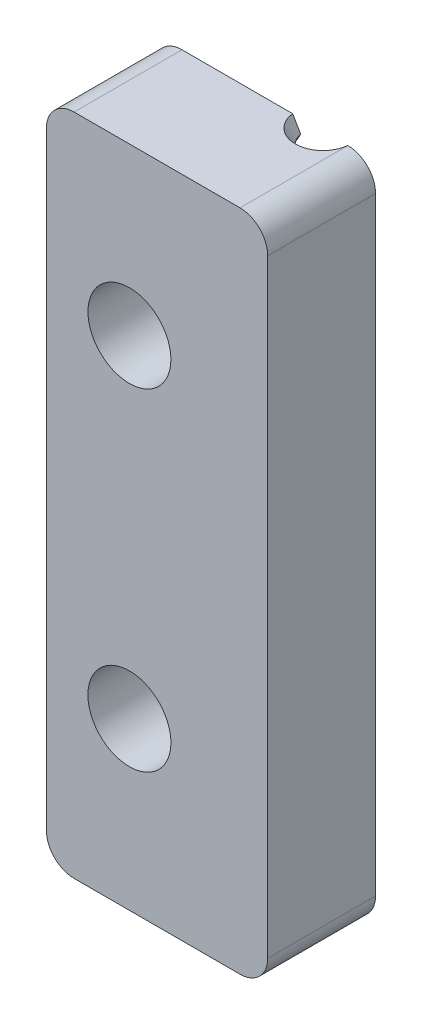
from build123d import *

# Parameters (mm, degrees)
ESQUISSE1_W                           = 8
ESQUISSE1_H                           = 3.9
BOSS_EXTRU_1_DEPTH                    = 12
ESQUISSE2_R                           = 1.5
ENL_V_MAT_EXTRU_1_DEPTH               = 14.23669143
ESQUISSE3_R                           = 1
ENL_V_MAT_EXTRU_2_DEPTH               = 0.5
ENL_V_MAT_EXTRU_2_DRAFT               = -30
ESQUISSE4_R                           = 0.711324865
ENL_V_MAT_EXTRU_3_DEPTH               = 0.5
ENL_V_MAT_EXTRU_3_DRAFT               = 30
R_P_TITION_LIN_AIRE1_COPY_1_SKETCH_R  = 1
R_P_TITION_LIN_AIRE1_COPY_1_DEPTH     = 0.5
R_P_TITION_LIN_AIRE1_COPY_1_DRAFT     = -30
R_P_TITION_LIN_AIRE1_COPY_2_SKETCH_R  = 1
R_P_TITION_LIN_AIRE1_COPY_2_DEPTH     = 0.5
R_P_TITION_LIN_AIRE1_COPY_2_DRAFT     = -30
R_P_TITION_LIN_AIRE1_COPY_3_SKETCH_R  = 1
R_P_TITION_LIN_AIRE1_COPY_3_DEPTH     = 0.5
R_P_TITION_LIN_AIRE1_COPY_3_DRAFT     = -30
R_P_TITION_LIN_AIRE1_COPY_4_SKETCH_R  = 1
R_P_TITION_LIN_AIRE1_COPY_4_DEPTH     = 0.5
R_P_TITION_LIN_AIRE1_COPY_4_DRAFT     = -30
R_P_TITION_LIN_AIRE1_COPY_5_SKETCH_R  = 1
R_P_TITION_LIN_AIRE1_COPY_5_DEPTH     = 0.5
R_P_TITION_LIN_AIRE1_COPY_5_DRAFT     = -30
R_P_TITION_LIN_AIRE1_COPY_6_SKETCH_R  = 1
R_P_TITION_LIN_AIRE1_COPY_6_DEPTH     = 0.5
R_P_TITION_LIN_AIRE1_COPY_6_DRAFT     = -30
R_P_TITION_LIN_AIRE1_COPY_7_SKETCH_R  = 1
R_P_TITION_LIN_AIRE1_COPY_7_DEPTH     = 0.5
R_P_TITION_LIN_AIRE1_COPY_7_DRAFT     = -30
R_P_TITION_LIN_AIRE1_COPY_8_SKETCH_R  = 1
R_P_TITION_LIN_AIRE1_COPY_8_DEPTH     = 0.5
R_P_TITION_LIN_AIRE1_COPY_8_DRAFT     = -30
R_P_TITION_LIN_AIRE1_COPY_9_SKETCH_R  = 1
R_P_TITION_LIN_AIRE1_COPY_9_DEPTH     = 0.5
R_P_TITION_LIN_AIRE1_COPY_9_DRAFT     = -30
R_P_TITION_LIN_AIRE1_COPY_10_SKETCH_R = 1
R_P_TITION_LIN_AIRE1_COPY_10_DEPTH    = 0.5
R_P_TITION_LIN_AIRE1_COPY_10_DRAFT    = -30
R_P_TITION_LIN_AIRE1_COPY_11_SKETCH_R = 1
R_P_TITION_LIN_AIRE1_COPY_11_DEPTH    = 0.5
R_P_TITION_LIN_AIRE1_COPY_11_DRAFT    = -30
R_P_TITION_LIN_AIRE1_COPY_12_SKETCH_R = 1
R_P_TITION_LIN_AIRE1_COPY_12_DEPTH    = 0.5
R_P_TITION_LIN_AIRE1_COPY_12_DRAFT    = -30
R_P_TITION_LIN_AIRE1_COPY_13_SKETCH_R = 1
R_P_TITION_LIN_AIRE1_COPY_13_DEPTH    = 0.5
R_P_TITION_LIN_AIRE1_COPY_13_DRAFT    = -30
R_P_TITION_LIN_AIRE1_COPY_14_SKETCH_R = 1
R_P_TITION_LIN_AIRE1_COPY_14_DEPTH    = 0.5
R_P_TITION_LIN_AIRE1_COPY_14_DRAFT    = -30
R_P_TITION_LIN_AIRE1_COPY_15_SKETCH_R = 1
R_P_TITION_LIN_AIRE1_COPY_15_DEPTH    = 0.5
R_P_TITION_LIN_AIRE1_COPY_15_DRAFT    = -30
R_P_TITION_LIN_AIRE1_COPY_16_SKETCH_R = 1
R_P_TITION_LIN_AIRE1_COPY_16_DEPTH    = 0.5
R_P_TITION_LIN_AIRE1_COPY_16_DRAFT    = -30
R_P_TITION_LIN_AIRE1_COPY_17_SKETCH_R = 1
R_P_TITION_LIN_AIRE1_COPY_17_DEPTH    = 0.5
R_P_TITION_LIN_AIRE1_COPY_17_DRAFT    = -30
R_P_TITION_LIN_AIRE1_COPY_18_SKETCH_R = 1
R_P_TITION_LIN_AIRE1_COPY_18_DEPTH    = 0.5
R_P_TITION_LIN_AIRE1_COPY_18_DRAFT    = -30
R_P_TITION_LIN_AIRE1_COPY_19_SKETCH_R = 1
R_P_TITION_LIN_AIRE1_COPY_19_DEPTH    = 0.5
R_P_TITION_LIN_AIRE1_COPY_19_DRAFT    = -30
R_P_TITION_LIN_AIRE1_COPY_20_SKETCH_R = 1
R_P_TITION_LIN_AIRE1_COPY_20_DEPTH    = 0.5
R_P_TITION_LIN_AIRE1_COPY_20_DRAFT    = -30
R_P_TITION_LIN_AIRE1_COPY_21_SKETCH_R = 1
R_P_TITION_LIN_AIRE1_COPY_21_DEPTH    = 0.5
R_P_TITION_LIN_AIRE1_COPY_21_DRAFT    = -30
R_P_TITION_LIN_AIRE1_COPY_22_SKETCH_R = 1
R_P_TITION_LIN_AIRE1_COPY_22_DEPTH    = 0.5
R_P_TITION_LIN_AIRE1_COPY_22_DRAFT    = -30
R_P_TITION_LIN_AIRE1_COPY_23_SKETCH_R = 1
R_P_TITION_LIN_AIRE1_COPY_23_DEPTH    = 0.5
R_P_TITION_LIN_AIRE1_COPY_23_DRAFT    = -30
R_P_TITION_LIN_AIRE1_COPY_24_SKETCH_R = 0.711324865
R_P_TITION_LIN_AIRE1_COPY_24_DEPTH    = 0.5
R_P_TITION_LIN_AIRE1_COPY_24_DRAFT    = 30
R_P_TITION_LIN_AIRE1_COPY_25_SKETCH_R = 0.711324865
R_P_TITION_LIN_AIRE1_COPY_25_DEPTH    = 0.5
R_P_TITION_LIN_AIRE1_COPY_25_DRAFT    = 30
R_P_TITION_LIN_AIRE1_COPY_26_SKETCH_R = 0.711324865
R_P_TITION_LIN_AIRE1_COPY_26_DEPTH    = 0.5
R_P_TITION_LIN_AIRE1_COPY_26_DRAFT    = 30
R_P_TITION_LIN_AIRE1_COPY_27_SKETCH_R = 0.711324865
R_P_TITION_LIN_AIRE1_COPY_27_DEPTH    = 0.5
R_P_TITION_LIN_AIRE1_COPY_27_DRAFT    = 30
R_P_TITION_LIN_AIRE1_COPY_28_SKETCH_R = 0.711324865
R_P_TITION_LIN_AIRE1_COPY_28_DEPTH    = 0.5
R_P_TITION_LIN_AIRE1_COPY_28_DRAFT    = 30
R_P_TITION_LIN_AIRE1_COPY_29_SKETCH_R = 0.711324865
R_P_TITION_LIN_AIRE1_COPY_29_DEPTH    = 0.5
R_P_TITION_LIN_AIRE1_COPY_29_DRAFT    = 30
R_P_TITION_LIN_AIRE1_COPY_30_SKETCH_R = 0.711324865
R_P_TITION_LIN_AIRE1_COPY_30_DEPTH    = 0.5
R_P_TITION_LIN_AIRE1_COPY_30_DRAFT    = 30
R_P_TITION_LIN_AIRE1_COPY_31_SKETCH_R = 0.711324865
R_P_TITION_LIN_AIRE1_COPY_31_DEPTH    = 0.5
R_P_TITION_LIN_AIRE1_COPY_31_DRAFT    = 30
R_P_TITION_LIN_AIRE1_COPY_32_SKETCH_R = 0.711324865
R_P_TITION_LIN_AIRE1_COPY_32_DEPTH    = 0.5
R_P_TITION_LIN_AIRE1_COPY_32_DRAFT    = 30
R_P_TITION_LIN_AIRE1_COPY_33_SKETCH_R = 0.711324865
R_P_TITION_LIN_AIRE1_COPY_33_DEPTH    = 0.5
R_P_TITION_LIN_AIRE1_COPY_33_DRAFT    = 30
R_P_TITION_LIN_AIRE1_COPY_34_SKETCH_R = 0.711324865
R_P_TITION_LIN_AIRE1_COPY_34_DEPTH    = 0.5
R_P_TITION_LIN_AIRE1_COPY_34_DRAFT    = 30
R_P_TITION_LIN_AIRE1_COPY_35_SKETCH_R = 0.711324865
R_P_TITION_LIN_AIRE1_COPY_35_DEPTH    = 0.5
R_P_TITION_LIN_AIRE1_COPY_35_DRAFT    = 30
R_P_TITION_LIN_AIRE1_COPY_36_SKETCH_R = 0.711324865
R_P_TITION_LIN_AIRE1_COPY_36_DEPTH    = 0.5
R_P_TITION_LIN_AIRE1_COPY_36_DRAFT    = 30
R_P_TITION_LIN_AIRE1_COPY_37_SKETCH_R = 0.711324865
R_P_TITION_LIN_AIRE1_COPY_37_DEPTH    = 0.5
R_P_TITION_LIN_AIRE1_COPY_37_DRAFT    = 30
R_P_TITION_LIN_AIRE1_COPY_38_SKETCH_R = 0.711324865
R_P_TITION_LIN_AIRE1_COPY_38_DEPTH    = 0.5
R_P_TITION_LIN_AIRE1_COPY_38_DRAFT    = 30
R_P_TITION_LIN_AIRE1_COPY_39_SKETCH_R = 0.711324865
R_P_TITION_LIN_AIRE1_COPY_39_DEPTH    = 0.5
R_P_TITION_LIN_AIRE1_COPY_39_DRAFT    = 30
R_P_TITION_LIN_AIRE1_COPY_40_SKETCH_R = 0.711324865
R_P_TITION_LIN_AIRE1_COPY_40_DEPTH    = 0.5
R_P_TITION_LIN_AIRE1_COPY_40_DRAFT    = 30
R_P_TITION_LIN_AIRE1_COPY_41_SKETCH_R = 0.711324865
R_P_TITION_LIN_AIRE1_COPY_41_DEPTH    = 0.5
R_P_TITION_LIN_AIRE1_COPY_41_DRAFT    = 30
R_P_TITION_LIN_AIRE1_COPY_42_SKETCH_R = 0.711324865
R_P_TITION_LIN_AIRE1_COPY_42_DEPTH    = 0.5
R_P_TITION_LIN_AIRE1_COPY_42_DRAFT    = 30
R_P_TITION_LIN_AIRE1_COPY_43_SKETCH_R = 0.711324865
R_P_TITION_LIN_AIRE1_COPY_43_DEPTH    = 0.5
R_P_TITION_LIN_AIRE1_COPY_43_DRAFT    = 30
R_P_TITION_LIN_AIRE1_COPY_44_SKETCH_R = 0.711324865
R_P_TITION_LIN_AIRE1_COPY_44_DEPTH    = 0.5
R_P_TITION_LIN_AIRE1_COPY_44_DRAFT    = 30
R_P_TITION_LIN_AIRE1_COPY_45_SKETCH_R = 0.711324865
R_P_TITION_LIN_AIRE1_COPY_45_DEPTH    = 0.5
R_P_TITION_LIN_AIRE1_COPY_45_DRAFT    = 30
R_P_TITION_LIN_AIRE1_COPY_46_SKETCH_R = 0.711324865
R_P_TITION_LIN_AIRE1_COPY_46_DEPTH    = 0.5
R_P_TITION_LIN_AIRE1_COPY_46_DRAFT    = 30
CONG_1_R                              = 1


with BuildPart() as part:
    # Esquisse1 → Boss.-Extru.1 (new, symmetric)
    with BuildSketch(Plane(origin=(0, 0, 0), x_dir=(1, 0, 0), z_dir=(0, 1, 0))):
        with Locations((0, 1.95)):
            Rectangle(ESQUISSE1_W, ESQUISSE1_H)
    extrude(amount=BOSS_EXTRU_1_DEPTH, both=True)

    # Esquisse2 → Enlèv. mat.-Extru.1 (cut, through all)
    with BuildSketch(Plane.XY):
        with Locations((-1, 6)):
            Circle(ESQUISSE2_R)
        with Locations(Location((-1, -6, 0), (0, 0, 180))):
            Circle(ESQUISSE2_R)
    extrude(amount=-ENL_V_MAT_EXTRU_1_DEPTH, mode=Mode.SUBTRACT)


with BuildPart() as enl_v_mat_extru_2_tool:
    # Esquisse3 → Enlèv. mat.-Extru.2 (with draft: the straight prism first)
    with BuildSketch(Plane(origin=(0, 12, 0), x_dir=(1, 0, 0), z_dir=(0, 1, 0))):
        with Locations((2, 4)):
            Circle(ESQUISSE3_R)
    extrude(amount=-ENL_V_MAT_EXTRU_2_DEPTH)
    # Enlèv. mat.-Extru.2: the draft: its side faces are tilted about the plane it starts from
    enl_v_mat_extru_2_sides = [enl_v_mat_extru_2_tool.faces().sort_by_distance(p)[0] for p in [
        (1, 11.75, -4),
    ]]
    draft(enl_v_mat_extru_2_sides, Plane(origin=(0, 12, 0), x_dir=(1, 0, 0), z_dir=(0, 1, 0)), ENL_V_MAT_EXTRU_2_DRAFT)


with BuildPart() as part_1:
    add(part.part)

    # Enlèv. mat.-Extru.2: cut by enl_v_mat_extru_2_tool
    add(enl_v_mat_extru_2_tool.part, mode=Mode.SUBTRACT)


with BuildPart() as enl_v_mat_extru_3_tool:
    # Esquisse4 → Enlèv. mat.-Extru.3 (with draft: the straight prism first)
    with BuildSketch(Plane(origin=(0, 11.5, 0), x_dir=(1, 0, 0), z_dir=(0, 1, 0))):
        with Locations((2, 4)):
            Circle(ESQUISSE4_R)
    extrude(amount=-ENL_V_MAT_EXTRU_3_DEPTH)
    # Enlèv. mat.-Extru.3: the draft: its side faces are tilted about the plane it starts from
    enl_v_mat_extru_3_sides = [enl_v_mat_extru_3_tool.faces().sort_by_distance(p)[0] for p in [
        (1.288675135, 11.25, -4),
    ]]
    draft(enl_v_mat_extru_3_sides, Plane(origin=(0, 11.5, 0), x_dir=(1, 0, 0), z_dir=(0, 1, 0)), ENL_V_MAT_EXTRU_3_DRAFT)


with BuildPart() as part_2:
    add(part_1.part)

    # Enlèv. mat.-Extru.3: cut by enl_v_mat_extru_3_tool
    add(enl_v_mat_extru_3_tool.part, mode=Mode.SUBTRACT)


with BuildPart() as r_p_tition_lin_aire1_copy_1_tool:
    # Répétition linéaire1 copy 1 sketch → Répétition linéaire1 copy 1 (with draft: the straight prism first)
    with BuildSketch(Plane(origin=(0, 11, 0), x_dir=(1, 0, 0), z_dir=(0, 1, 0))):
        with Locations((2, 4)):
            Circle(R_P_TITION_LIN_AIRE1_COPY_1_SKETCH_R)
    extrude(amount=-R_P_TITION_LIN_AIRE1_COPY_1_DEPTH)
    # Répétition linéaire1 copy 1: the draft: its side faces are tilted about the plane it starts from
    r_p_tition_lin_aire1_copy_1_sides = [r_p_tition_lin_aire1_copy_1_tool.faces().sort_by_distance(p)[0] for p in [
        (1, 10.75, -4),
    ]]
    draft(r_p_tition_lin_aire1_copy_1_sides, Plane(origin=(0, 11, 0), x_dir=(1, 0, 0), z_dir=(0, 1, 0)), R_P_TITION_LIN_AIRE1_COPY_1_DRAFT)


with BuildPart() as part_3:
    add(part_2.part)

    # Répétition linéaire1 copy 1: cut by r_p_tition_lin_aire1_copy_1_tool
    add(r_p_tition_lin_aire1_copy_1_tool.part, mode=Mode.SUBTRACT)


with BuildPart() as r_p_tition_lin_aire1_copy_2_tool:
    # Répétition linéaire1 copy 2 sketch → Répétition linéaire1 copy 2 (with draft: the straight prism first)
    with BuildSketch(Plane(origin=(0, 10, 0), x_dir=(1, 0, 0), z_dir=(0, 1, 0))):
        with Locations((2, 4)):
            Circle(R_P_TITION_LIN_AIRE1_COPY_2_SKETCH_R)
    extrude(amount=-R_P_TITION_LIN_AIRE1_COPY_2_DEPTH)
    # Répétition linéaire1 copy 2: the draft: its side faces are tilted about the plane it starts from
    r_p_tition_lin_aire1_copy_2_sides = [r_p_tition_lin_aire1_copy_2_tool.faces().sort_by_distance(p)[0] for p in [
        (1, 9.75, -4),
    ]]
    draft(r_p_tition_lin_aire1_copy_2_sides, Plane(origin=(0, 10, 0), x_dir=(1, 0, 0), z_dir=(0, 1, 0)), R_P_TITION_LIN_AIRE1_COPY_2_DRAFT)


with BuildPart() as part_4:
    add(part_3.part)

    # Répétition linéaire1 copy 2: cut by r_p_tition_lin_aire1_copy_2_tool
    add(r_p_tition_lin_aire1_copy_2_tool.part, mode=Mode.SUBTRACT)


with BuildPart() as r_p_tition_lin_aire1_copy_3_tool:
    # Répétition linéaire1 copy 3 sketch → Répétition linéaire1 copy 3 (with draft: the straight prism first)
    with BuildSketch(Plane(origin=(0, 9, 0), x_dir=(1, 0, 0), z_dir=(0, 1, 0))):
        with Locations((2, 4)):
            Circle(R_P_TITION_LIN_AIRE1_COPY_3_SKETCH_R)
    extrude(amount=-R_P_TITION_LIN_AIRE1_COPY_3_DEPTH)
    # Répétition linéaire1 copy 3: the draft: its side faces are tilted about the plane it starts from
    r_p_tition_lin_aire1_copy_3_sides = [r_p_tition_lin_aire1_copy_3_tool.faces().sort_by_distance(p)[0] for p in [
        (1, 8.75, -4),
    ]]
    draft(r_p_tition_lin_aire1_copy_3_sides, Plane(origin=(0, 9, 0), x_dir=(1, 0, 0), z_dir=(0, 1, 0)), R_P_TITION_LIN_AIRE1_COPY_3_DRAFT)


with BuildPart() as part_5:
    add(part_4.part)

    # Répétition linéaire1 copy 3: cut by r_p_tition_lin_aire1_copy_3_tool
    add(r_p_tition_lin_aire1_copy_3_tool.part, mode=Mode.SUBTRACT)


with BuildPart() as r_p_tition_lin_aire1_copy_4_tool:
    # Répétition linéaire1 copy 4 sketch → Répétition linéaire1 copy 4 (with draft: the straight prism first)
    with BuildSketch(Plane(origin=(0, 8, 0), x_dir=(1, 0, 0), z_dir=(0, 1, 0))):
        with Locations((2, 4)):
            Circle(R_P_TITION_LIN_AIRE1_COPY_4_SKETCH_R)
    extrude(amount=-R_P_TITION_LIN_AIRE1_COPY_4_DEPTH)
    # Répétition linéaire1 copy 4: the draft: its side faces are tilted about the plane it starts from
    r_p_tition_lin_aire1_copy_4_sides = [r_p_tition_lin_aire1_copy_4_tool.faces().sort_by_distance(p)[0] for p in [
        (1, 7.75, -4),
    ]]
    draft(r_p_tition_lin_aire1_copy_4_sides, Plane(origin=(0, 8, 0), x_dir=(1, 0, 0), z_dir=(0, 1, 0)), R_P_TITION_LIN_AIRE1_COPY_4_DRAFT)


with BuildPart() as part_6:
    add(part_5.part)

    # Répétition linéaire1 copy 4: cut by r_p_tition_lin_aire1_copy_4_tool
    add(r_p_tition_lin_aire1_copy_4_tool.part, mode=Mode.SUBTRACT)


with BuildPart() as r_p_tition_lin_aire1_copy_5_tool:
    # Répétition linéaire1 copy 5 sketch → Répétition linéaire1 copy 5 (with draft: the straight prism first)
    with BuildSketch(Plane(origin=(0, 7, 0), x_dir=(1, 0, 0), z_dir=(0, 1, 0))):
        with Locations((2, 4)):
            Circle(R_P_TITION_LIN_AIRE1_COPY_5_SKETCH_R)
    extrude(amount=-R_P_TITION_LIN_AIRE1_COPY_5_DEPTH)
    # Répétition linéaire1 copy 5: the draft: its side faces are tilted about the plane it starts from
    r_p_tition_lin_aire1_copy_5_sides = [r_p_tition_lin_aire1_copy_5_tool.faces().sort_by_distance(p)[0] for p in [
        (1, 6.75, -4),
    ]]
    draft(r_p_tition_lin_aire1_copy_5_sides, Plane(origin=(0, 7, 0), x_dir=(1, 0, 0), z_dir=(0, 1, 0)), R_P_TITION_LIN_AIRE1_COPY_5_DRAFT)


with BuildPart() as part_7:
    add(part_6.part)

    # Répétition linéaire1 copy 5: cut by r_p_tition_lin_aire1_copy_5_tool
    add(r_p_tition_lin_aire1_copy_5_tool.part, mode=Mode.SUBTRACT)


with BuildPart() as r_p_tition_lin_aire1_copy_6_tool:
    # Répétition linéaire1 copy 6 sketch → Répétition linéaire1 copy 6 (with draft: the straight prism first)
    with BuildSketch(Plane(origin=(0, 6, 0), x_dir=(1, 0, 0), z_dir=(0, 1, 0))):
        with Locations((2, 4)):
            Circle(R_P_TITION_LIN_AIRE1_COPY_6_SKETCH_R)
    extrude(amount=-R_P_TITION_LIN_AIRE1_COPY_6_DEPTH)
    # Répétition linéaire1 copy 6: the draft: its side faces are tilted about the plane it starts from
    r_p_tition_lin_aire1_copy_6_sides = [r_p_tition_lin_aire1_copy_6_tool.faces().sort_by_distance(p)[0] for p in [
        (1, 5.75, -4),
    ]]
    draft(r_p_tition_lin_aire1_copy_6_sides, Plane(origin=(0, 6, 0), x_dir=(1, 0, 0), z_dir=(0, 1, 0)), R_P_TITION_LIN_AIRE1_COPY_6_DRAFT)


with BuildPart() as part_8:
    add(part_7.part)

    # Répétition linéaire1 copy 6: cut by r_p_tition_lin_aire1_copy_6_tool
    add(r_p_tition_lin_aire1_copy_6_tool.part, mode=Mode.SUBTRACT)


with BuildPart() as r_p_tition_lin_aire1_copy_7_tool:
    # Répétition linéaire1 copy 7 sketch → Répétition linéaire1 copy 7 (with draft: the straight prism first)
    with BuildSketch(Plane(origin=(0, 5, 0), x_dir=(1, 0, 0), z_dir=(0, 1, 0))):
        with Locations((2, 4)):
            Circle(R_P_TITION_LIN_AIRE1_COPY_7_SKETCH_R)
    extrude(amount=-R_P_TITION_LIN_AIRE1_COPY_7_DEPTH)
    # Répétition linéaire1 copy 7: the draft: its side faces are tilted about the plane it starts from
    r_p_tition_lin_aire1_copy_7_sides = [r_p_tition_lin_aire1_copy_7_tool.faces().sort_by_distance(p)[0] for p in [
        (1, 4.75, -4),
    ]]
    draft(r_p_tition_lin_aire1_copy_7_sides, Plane(origin=(0, 5, 0), x_dir=(1, 0, 0), z_dir=(0, 1, 0)), R_P_TITION_LIN_AIRE1_COPY_7_DRAFT)


with BuildPart() as part_9:
    add(part_8.part)

    # Répétition linéaire1 copy 7: cut by r_p_tition_lin_aire1_copy_7_tool
    add(r_p_tition_lin_aire1_copy_7_tool.part, mode=Mode.SUBTRACT)


with BuildPart() as r_p_tition_lin_aire1_copy_8_tool:
    # Répétition linéaire1 copy 8 sketch → Répétition linéaire1 copy 8 (with draft: the straight prism first)
    with BuildSketch(Plane(origin=(0, 4, 0), x_dir=(1, 0, 0), z_dir=(0, 1, 0))):
        with Locations((2, 4)):
            Circle(R_P_TITION_LIN_AIRE1_COPY_8_SKETCH_R)
    extrude(amount=-R_P_TITION_LIN_AIRE1_COPY_8_DEPTH)
    # Répétition linéaire1 copy 8: the draft: its side faces are tilted about the plane it starts from
    r_p_tition_lin_aire1_copy_8_sides = [r_p_tition_lin_aire1_copy_8_tool.faces().sort_by_distance(p)[0] for p in [
        (1, 3.75, -4),
    ]]
    draft(r_p_tition_lin_aire1_copy_8_sides, Plane(origin=(0, 4, 0), x_dir=(1, 0, 0), z_dir=(0, 1, 0)), R_P_TITION_LIN_AIRE1_COPY_8_DRAFT)


with BuildPart() as part_10:
    add(part_9.part)

    # Répétition linéaire1 copy 8: cut by r_p_tition_lin_aire1_copy_8_tool
    add(r_p_tition_lin_aire1_copy_8_tool.part, mode=Mode.SUBTRACT)


with BuildPart() as r_p_tition_lin_aire1_copy_9_tool:
    # Répétition linéaire1 copy 9 sketch → Répétition linéaire1 copy 9 (with draft: the straight prism first)
    with BuildSketch(Plane(origin=(0, 3, 0), x_dir=(1, 0, 0), z_dir=(0, 1, 0))):
        with Locations((2, 4)):
            Circle(R_P_TITION_LIN_AIRE1_COPY_9_SKETCH_R)
    extrude(amount=-R_P_TITION_LIN_AIRE1_COPY_9_DEPTH)
    # Répétition linéaire1 copy 9: the draft: its side faces are tilted about the plane it starts from
    r_p_tition_lin_aire1_copy_9_sides = [r_p_tition_lin_aire1_copy_9_tool.faces().sort_by_distance(p)[0] for p in [
        (1, 2.75, -4),
    ]]
    draft(r_p_tition_lin_aire1_copy_9_sides, Plane(origin=(0, 3, 0), x_dir=(1, 0, 0), z_dir=(0, 1, 0)), R_P_TITION_LIN_AIRE1_COPY_9_DRAFT)


with BuildPart() as part_11:
    add(part_10.part)

    # Répétition linéaire1 copy 9: cut by r_p_tition_lin_aire1_copy_9_tool
    add(r_p_tition_lin_aire1_copy_9_tool.part, mode=Mode.SUBTRACT)


with BuildPart() as r_p_tition_lin_aire1_copy_10_tool:
    # Répétition linéaire1 copy 10 sketch → Répétition linéaire1 copy 10 (with draft: the straight prism first)
    with BuildSketch(Plane(origin=(0, 2, 0), x_dir=(1, 0, 0), z_dir=(0, 1, 0))):
        with Locations((2, 4)):
            Circle(R_P_TITION_LIN_AIRE1_COPY_10_SKETCH_R)
    extrude(amount=-R_P_TITION_LIN_AIRE1_COPY_10_DEPTH)
    # Répétition linéaire1 copy 10: the draft: its side faces are tilted about the plane it starts from
    r_p_tition_lin_aire1_copy_10_sides = [r_p_tition_lin_aire1_copy_10_tool.faces().sort_by_distance(p)[0] for p in [
        (1, 1.75, -4),
    ]]
    draft(r_p_tition_lin_aire1_copy_10_sides, Plane(origin=(0, 2, 0), x_dir=(1, 0, 0), z_dir=(0, 1, 0)), R_P_TITION_LIN_AIRE1_COPY_10_DRAFT)


with BuildPart() as part_12:
    add(part_11.part)

    # Répétition linéaire1 copy 10: cut by r_p_tition_lin_aire1_copy_10_tool
    add(r_p_tition_lin_aire1_copy_10_tool.part, mode=Mode.SUBTRACT)


with BuildPart() as r_p_tition_lin_aire1_copy_11_tool:
    # Répétition linéaire1 copy 11 sketch → Répétition linéaire1 copy 11 (with draft: the straight prism first)
    with BuildSketch(Plane(origin=(0, 1, 0), x_dir=(1, 0, 0), z_dir=(0, 1, 0))):
        with Locations((2, 4)):
            Circle(R_P_TITION_LIN_AIRE1_COPY_11_SKETCH_R)
    extrude(amount=-R_P_TITION_LIN_AIRE1_COPY_11_DEPTH)
    # Répétition linéaire1 copy 11: the draft: its side faces are tilted about the plane it starts from
    r_p_tition_lin_aire1_copy_11_sides = [r_p_tition_lin_aire1_copy_11_tool.faces().sort_by_distance(p)[0] for p in [
        (1, 0.75, -4),
    ]]
    draft(r_p_tition_lin_aire1_copy_11_sides, Plane(origin=(0, 1, 0), x_dir=(1, 0, 0), z_dir=(0, 1, 0)), R_P_TITION_LIN_AIRE1_COPY_11_DRAFT)


with BuildPart() as part_13:
    add(part_12.part)

    # Répétition linéaire1 copy 11: cut by r_p_tition_lin_aire1_copy_11_tool
    add(r_p_tition_lin_aire1_copy_11_tool.part, mode=Mode.SUBTRACT)


with BuildPart() as r_p_tition_lin_aire1_copy_12_tool:
    # Répétition linéaire1 copy 12 sketch → Répétition linéaire1 copy 12 (with draft: the straight prism first)
    with BuildSketch(Plane(origin=(0, 0, 0), x_dir=(1, 0, 0), z_dir=(0, 1, 0))):
        with Locations((2, 4)):
            Circle(R_P_TITION_LIN_AIRE1_COPY_12_SKETCH_R)
    extrude(amount=-R_P_TITION_LIN_AIRE1_COPY_12_DEPTH)
    # Répétition linéaire1 copy 12: the draft: its side faces are tilted about the plane it starts from
    r_p_tition_lin_aire1_copy_12_sides = [r_p_tition_lin_aire1_copy_12_tool.faces().sort_by_distance(p)[0] for p in [
        (1, -0.25, -4),
    ]]
    draft(r_p_tition_lin_aire1_copy_12_sides, Plane(origin=(0, 0, 0), x_dir=(1, 0, 0), z_dir=(0, 1, 0)), R_P_TITION_LIN_AIRE1_COPY_12_DRAFT)


with BuildPart() as part_14:
    add(part_13.part)

    # Répétition linéaire1 copy 12: cut by r_p_tition_lin_aire1_copy_12_tool
    add(r_p_tition_lin_aire1_copy_12_tool.part, mode=Mode.SUBTRACT)


with BuildPart() as r_p_tition_lin_aire1_copy_13_tool:
    # Répétition linéaire1 copy 13 sketch → Répétition linéaire1 copy 13 (with draft: the straight prism first)
    with BuildSketch(Plane(origin=(0, -1, 0), x_dir=(1, 0, 0), z_dir=(0, 1, 0))):
        with Locations((2, 4)):
            Circle(R_P_TITION_LIN_AIRE1_COPY_13_SKETCH_R)
    extrude(amount=-R_P_TITION_LIN_AIRE1_COPY_13_DEPTH)
    # Répétition linéaire1 copy 13: the draft: its side faces are tilted about the plane it starts from
    r_p_tition_lin_aire1_copy_13_sides = [r_p_tition_lin_aire1_copy_13_tool.faces().sort_by_distance(p)[0] for p in [
        (1, -1.25, -4),
    ]]
    draft(r_p_tition_lin_aire1_copy_13_sides, Plane(origin=(0, -1, 0), x_dir=(1, 0, 0), z_dir=(0, 1, 0)), R_P_TITION_LIN_AIRE1_COPY_13_DRAFT)


with BuildPart() as part_15:
    add(part_14.part)

    # Répétition linéaire1 copy 13: cut by r_p_tition_lin_aire1_copy_13_tool
    add(r_p_tition_lin_aire1_copy_13_tool.part, mode=Mode.SUBTRACT)


with BuildPart() as r_p_tition_lin_aire1_copy_14_tool:
    # Répétition linéaire1 copy 14 sketch → Répétition linéaire1 copy 14 (with draft: the straight prism first)
    with BuildSketch(Plane(origin=(0, -2, 0), x_dir=(1, 0, 0), z_dir=(0, 1, 0))):
        with Locations((2, 4)):
            Circle(R_P_TITION_LIN_AIRE1_COPY_14_SKETCH_R)
    extrude(amount=-R_P_TITION_LIN_AIRE1_COPY_14_DEPTH)
    # Répétition linéaire1 copy 14: the draft: its side faces are tilted about the plane it starts from
    r_p_tition_lin_aire1_copy_14_sides = [r_p_tition_lin_aire1_copy_14_tool.faces().sort_by_distance(p)[0] for p in [
        (1, -2.25, -4),
    ]]
    draft(r_p_tition_lin_aire1_copy_14_sides, Plane(origin=(0, -2, 0), x_dir=(1, 0, 0), z_dir=(0, 1, 0)), R_P_TITION_LIN_AIRE1_COPY_14_DRAFT)


with BuildPart() as part_16:
    add(part_15.part)

    # Répétition linéaire1 copy 14: cut by r_p_tition_lin_aire1_copy_14_tool
    add(r_p_tition_lin_aire1_copy_14_tool.part, mode=Mode.SUBTRACT)


with BuildPart() as r_p_tition_lin_aire1_copy_15_tool:
    # Répétition linéaire1 copy 15 sketch → Répétition linéaire1 copy 15 (with draft: the straight prism first)
    with BuildSketch(Plane(origin=(0, -3, 0), x_dir=(1, 0, 0), z_dir=(0, 1, 0))):
        with Locations((2, 4)):
            Circle(R_P_TITION_LIN_AIRE1_COPY_15_SKETCH_R)
    extrude(amount=-R_P_TITION_LIN_AIRE1_COPY_15_DEPTH)
    # Répétition linéaire1 copy 15: the draft: its side faces are tilted about the plane it starts from
    r_p_tition_lin_aire1_copy_15_sides = [r_p_tition_lin_aire1_copy_15_tool.faces().sort_by_distance(p)[0] for p in [
        (1, -3.25, -4),
    ]]
    draft(r_p_tition_lin_aire1_copy_15_sides, Plane(origin=(0, -3, 0), x_dir=(1, 0, 0), z_dir=(0, 1, 0)), R_P_TITION_LIN_AIRE1_COPY_15_DRAFT)


with BuildPart() as part_17:
    add(part_16.part)

    # Répétition linéaire1 copy 15: cut by r_p_tition_lin_aire1_copy_15_tool
    add(r_p_tition_lin_aire1_copy_15_tool.part, mode=Mode.SUBTRACT)


with BuildPart() as r_p_tition_lin_aire1_copy_16_tool:
    # Répétition linéaire1 copy 16 sketch → Répétition linéaire1 copy 16 (with draft: the straight prism first)
    with BuildSketch(Plane(origin=(0, -4, 0), x_dir=(1, 0, 0), z_dir=(0, 1, 0))):
        with Locations((2, 4)):
            Circle(R_P_TITION_LIN_AIRE1_COPY_16_SKETCH_R)
    extrude(amount=-R_P_TITION_LIN_AIRE1_COPY_16_DEPTH)
    # Répétition linéaire1 copy 16: the draft: its side faces are tilted about the plane it starts from
    r_p_tition_lin_aire1_copy_16_sides = [r_p_tition_lin_aire1_copy_16_tool.faces().sort_by_distance(p)[0] for p in [
        (1, -4.25, -4),
    ]]
    draft(r_p_tition_lin_aire1_copy_16_sides, Plane(origin=(0, -4, 0), x_dir=(1, 0, 0), z_dir=(0, 1, 0)), R_P_TITION_LIN_AIRE1_COPY_16_DRAFT)


with BuildPart() as part_18:
    add(part_17.part)

    # Répétition linéaire1 copy 16: cut by r_p_tition_lin_aire1_copy_16_tool
    add(r_p_tition_lin_aire1_copy_16_tool.part, mode=Mode.SUBTRACT)


with BuildPart() as r_p_tition_lin_aire1_copy_17_tool:
    # Répétition linéaire1 copy 17 sketch → Répétition linéaire1 copy 17 (with draft: the straight prism first)
    with BuildSketch(Plane(origin=(0, -5, 0), x_dir=(1, 0, 0), z_dir=(0, 1, 0))):
        with Locations((2, 4)):
            Circle(R_P_TITION_LIN_AIRE1_COPY_17_SKETCH_R)
    extrude(amount=-R_P_TITION_LIN_AIRE1_COPY_17_DEPTH)
    # Répétition linéaire1 copy 17: the draft: its side faces are tilted about the plane it starts from
    r_p_tition_lin_aire1_copy_17_sides = [r_p_tition_lin_aire1_copy_17_tool.faces().sort_by_distance(p)[0] for p in [
        (1, -5.25, -4),
    ]]
    draft(r_p_tition_lin_aire1_copy_17_sides, Plane(origin=(0, -5, 0), x_dir=(1, 0, 0), z_dir=(0, 1, 0)), R_P_TITION_LIN_AIRE1_COPY_17_DRAFT)


with BuildPart() as part_19:
    add(part_18.part)

    # Répétition linéaire1 copy 17: cut by r_p_tition_lin_aire1_copy_17_tool
    add(r_p_tition_lin_aire1_copy_17_tool.part, mode=Mode.SUBTRACT)


with BuildPart() as r_p_tition_lin_aire1_copy_18_tool:
    # Répétition linéaire1 copy 18 sketch → Répétition linéaire1 copy 18 (with draft: the straight prism first)
    with BuildSketch(Plane(origin=(0, -6, 0), x_dir=(1, 0, 0), z_dir=(0, 1, 0))):
        with Locations((2, 4)):
            Circle(R_P_TITION_LIN_AIRE1_COPY_18_SKETCH_R)
    extrude(amount=-R_P_TITION_LIN_AIRE1_COPY_18_DEPTH)
    # Répétition linéaire1 copy 18: the draft: its side faces are tilted about the plane it starts from
    r_p_tition_lin_aire1_copy_18_sides = [r_p_tition_lin_aire1_copy_18_tool.faces().sort_by_distance(p)[0] for p in [
        (1, -6.25, -4),
    ]]
    draft(r_p_tition_lin_aire1_copy_18_sides, Plane(origin=(0, -6, 0), x_dir=(1, 0, 0), z_dir=(0, 1, 0)), R_P_TITION_LIN_AIRE1_COPY_18_DRAFT)


with BuildPart() as part_20:
    add(part_19.part)

    # Répétition linéaire1 copy 18: cut by r_p_tition_lin_aire1_copy_18_tool
    add(r_p_tition_lin_aire1_copy_18_tool.part, mode=Mode.SUBTRACT)


with BuildPart() as r_p_tition_lin_aire1_copy_19_tool:
    # Répétition linéaire1 copy 19 sketch → Répétition linéaire1 copy 19 (with draft: the straight prism first)
    with BuildSketch(Plane(origin=(0, -7, 0), x_dir=(1, 0, 0), z_dir=(0, 1, 0))):
        with Locations((2, 4)):
            Circle(R_P_TITION_LIN_AIRE1_COPY_19_SKETCH_R)
    extrude(amount=-R_P_TITION_LIN_AIRE1_COPY_19_DEPTH)
    # Répétition linéaire1 copy 19: the draft: its side faces are tilted about the plane it starts from
    r_p_tition_lin_aire1_copy_19_sides = [r_p_tition_lin_aire1_copy_19_tool.faces().sort_by_distance(p)[0] for p in [
        (1, -7.25, -4),
    ]]
    draft(r_p_tition_lin_aire1_copy_19_sides, Plane(origin=(0, -7, 0), x_dir=(1, 0, 0), z_dir=(0, 1, 0)), R_P_TITION_LIN_AIRE1_COPY_19_DRAFT)


with BuildPart() as part_21:
    add(part_20.part)

    # Répétition linéaire1 copy 19: cut by r_p_tition_lin_aire1_copy_19_tool
    add(r_p_tition_lin_aire1_copy_19_tool.part, mode=Mode.SUBTRACT)


with BuildPart() as r_p_tition_lin_aire1_copy_20_tool:
    # Répétition linéaire1 copy 20 sketch → Répétition linéaire1 copy 20 (with draft: the straight prism first)
    with BuildSketch(Plane(origin=(0, -8, 0), x_dir=(1, 0, 0), z_dir=(0, 1, 0))):
        with Locations((2, 4)):
            Circle(R_P_TITION_LIN_AIRE1_COPY_20_SKETCH_R)
    extrude(amount=-R_P_TITION_LIN_AIRE1_COPY_20_DEPTH)
    # Répétition linéaire1 copy 20: the draft: its side faces are tilted about the plane it starts from
    r_p_tition_lin_aire1_copy_20_sides = [r_p_tition_lin_aire1_copy_20_tool.faces().sort_by_distance(p)[0] for p in [
        (1, -8.25, -4),
    ]]
    draft(r_p_tition_lin_aire1_copy_20_sides, Plane(origin=(0, -8, 0), x_dir=(1, 0, 0), z_dir=(0, 1, 0)), R_P_TITION_LIN_AIRE1_COPY_20_DRAFT)


with BuildPart() as part_22:
    add(part_21.part)

    # Répétition linéaire1 copy 20: cut by r_p_tition_lin_aire1_copy_20_tool
    add(r_p_tition_lin_aire1_copy_20_tool.part, mode=Mode.SUBTRACT)


with BuildPart() as r_p_tition_lin_aire1_copy_21_tool:
    # Répétition linéaire1 copy 21 sketch → Répétition linéaire1 copy 21 (with draft: the straight prism first)
    with BuildSketch(Plane(origin=(0, -9, 0), x_dir=(1, 0, 0), z_dir=(0, 1, 0))):
        with Locations((2, 4)):
            Circle(R_P_TITION_LIN_AIRE1_COPY_21_SKETCH_R)
    extrude(amount=-R_P_TITION_LIN_AIRE1_COPY_21_DEPTH)
    # Répétition linéaire1 copy 21: the draft: its side faces are tilted about the plane it starts from
    r_p_tition_lin_aire1_copy_21_sides = [r_p_tition_lin_aire1_copy_21_tool.faces().sort_by_distance(p)[0] for p in [
        (1, -9.25, -4),
    ]]
    draft(r_p_tition_lin_aire1_copy_21_sides, Plane(origin=(0, -9, 0), x_dir=(1, 0, 0), z_dir=(0, 1, 0)), R_P_TITION_LIN_AIRE1_COPY_21_DRAFT)


with BuildPart() as part_23:
    add(part_22.part)

    # Répétition linéaire1 copy 21: cut by r_p_tition_lin_aire1_copy_21_tool
    add(r_p_tition_lin_aire1_copy_21_tool.part, mode=Mode.SUBTRACT)


with BuildPart() as r_p_tition_lin_aire1_copy_22_tool:
    # Répétition linéaire1 copy 22 sketch → Répétition linéaire1 copy 22 (with draft: the straight prism first)
    with BuildSketch(Plane(origin=(0, -10, 0), x_dir=(1, 0, 0), z_dir=(0, 1, 0))):
        with Locations((2, 4)):
            Circle(R_P_TITION_LIN_AIRE1_COPY_22_SKETCH_R)
    extrude(amount=-R_P_TITION_LIN_AIRE1_COPY_22_DEPTH)
    # Répétition linéaire1 copy 22: the draft: its side faces are tilted about the plane it starts from
    r_p_tition_lin_aire1_copy_22_sides = [r_p_tition_lin_aire1_copy_22_tool.faces().sort_by_distance(p)[0] for p in [
        (1, -10.25, -4),
    ]]
    draft(r_p_tition_lin_aire1_copy_22_sides, Plane(origin=(0, -10, 0), x_dir=(1, 0, 0), z_dir=(0, 1, 0)), R_P_TITION_LIN_AIRE1_COPY_22_DRAFT)


with BuildPart() as part_24:
    add(part_23.part)

    # Répétition linéaire1 copy 22: cut by r_p_tition_lin_aire1_copy_22_tool
    add(r_p_tition_lin_aire1_copy_22_tool.part, mode=Mode.SUBTRACT)


with BuildPart() as r_p_tition_lin_aire1_copy_23_tool:
    # Répétition linéaire1 copy 23 sketch → Répétition linéaire1 copy 23 (with draft: the straight prism first)
    with BuildSketch(Plane(origin=(0, -11, 0), x_dir=(1, 0, 0), z_dir=(0, 1, 0))):
        with Locations((2, 4)):
            Circle(R_P_TITION_LIN_AIRE1_COPY_23_SKETCH_R)
    extrude(amount=-R_P_TITION_LIN_AIRE1_COPY_23_DEPTH)
    # Répétition linéaire1 copy 23: the draft: its side faces are tilted about the plane it starts from
    r_p_tition_lin_aire1_copy_23_sides = [r_p_tition_lin_aire1_copy_23_tool.faces().sort_by_distance(p)[0] for p in [
        (1, -11.25, -4),
    ]]
    draft(r_p_tition_lin_aire1_copy_23_sides, Plane(origin=(0, -11, 0), x_dir=(1, 0, 0), z_dir=(0, 1, 0)), R_P_TITION_LIN_AIRE1_COPY_23_DRAFT)


with BuildPart() as part_25:
    add(part_24.part)

    # Répétition linéaire1 copy 23: cut by r_p_tition_lin_aire1_copy_23_tool
    add(r_p_tition_lin_aire1_copy_23_tool.part, mode=Mode.SUBTRACT)


with BuildPart() as r_p_tition_lin_aire1_copy_24_tool:
    # Répétition linéaire1 copy 24 sketch → Répétition linéaire1 copy 24 (with draft: the straight prism first)
    with BuildSketch(Plane(origin=(0, 10.5, 0), x_dir=(1, 0, 0), z_dir=(0, 1, 0))):
        with Locations((2, 4)):
            Circle(R_P_TITION_LIN_AIRE1_COPY_24_SKETCH_R)
    extrude(amount=-R_P_TITION_LIN_AIRE1_COPY_24_DEPTH)
    # Répétition linéaire1 copy 24: the draft: its side faces are tilted about the plane it starts from
    r_p_tition_lin_aire1_copy_24_sides = [r_p_tition_lin_aire1_copy_24_tool.faces().sort_by_distance(p)[0] for p in [
        (1.288675135, 10.25, -4),
    ]]
    draft(r_p_tition_lin_aire1_copy_24_sides, Plane(origin=(0, 10.5, 0), x_dir=(1, 0, 0), z_dir=(0, 1, 0)), R_P_TITION_LIN_AIRE1_COPY_24_DRAFT)


with BuildPart() as part_26:
    add(part_25.part)

    # Répétition linéaire1 copy 24: cut by r_p_tition_lin_aire1_copy_24_tool
    add(r_p_tition_lin_aire1_copy_24_tool.part, mode=Mode.SUBTRACT)


with BuildPart() as r_p_tition_lin_aire1_copy_25_tool:
    # Répétition linéaire1 copy 25 sketch → Répétition linéaire1 copy 25 (with draft: the straight prism first)
    with BuildSketch(Plane(origin=(0, 9.5, 0), x_dir=(1, 0, 0), z_dir=(0, 1, 0))):
        with Locations((2, 4)):
            Circle(R_P_TITION_LIN_AIRE1_COPY_25_SKETCH_R)
    extrude(amount=-R_P_TITION_LIN_AIRE1_COPY_25_DEPTH)
    # Répétition linéaire1 copy 25: the draft: its side faces are tilted about the plane it starts from
    r_p_tition_lin_aire1_copy_25_sides = [r_p_tition_lin_aire1_copy_25_tool.faces().sort_by_distance(p)[0] for p in [
        (1.288675135, 9.25, -4),
    ]]
    draft(r_p_tition_lin_aire1_copy_25_sides, Plane(origin=(0, 9.5, 0), x_dir=(1, 0, 0), z_dir=(0, 1, 0)), R_P_TITION_LIN_AIRE1_COPY_25_DRAFT)


with BuildPart() as part_27:
    add(part_26.part)

    # Répétition linéaire1 copy 25: cut by r_p_tition_lin_aire1_copy_25_tool
    add(r_p_tition_lin_aire1_copy_25_tool.part, mode=Mode.SUBTRACT)


with BuildPart() as r_p_tition_lin_aire1_copy_26_tool:
    # Répétition linéaire1 copy 26 sketch → Répétition linéaire1 copy 26 (with draft: the straight prism first)
    with BuildSketch(Plane(origin=(0, 8.5, 0), x_dir=(1, 0, 0), z_dir=(0, 1, 0))):
        with Locations((2, 4)):
            Circle(R_P_TITION_LIN_AIRE1_COPY_26_SKETCH_R)
    extrude(amount=-R_P_TITION_LIN_AIRE1_COPY_26_DEPTH)
    # Répétition linéaire1 copy 26: the draft: its side faces are tilted about the plane it starts from
    r_p_tition_lin_aire1_copy_26_sides = [r_p_tition_lin_aire1_copy_26_tool.faces().sort_by_distance(p)[0] for p in [
        (1.288675135, 8.25, -4),
    ]]
    draft(r_p_tition_lin_aire1_copy_26_sides, Plane(origin=(0, 8.5, 0), x_dir=(1, 0, 0), z_dir=(0, 1, 0)), R_P_TITION_LIN_AIRE1_COPY_26_DRAFT)


with BuildPart() as part_28:
    add(part_27.part)

    # Répétition linéaire1 copy 26: cut by r_p_tition_lin_aire1_copy_26_tool
    add(r_p_tition_lin_aire1_copy_26_tool.part, mode=Mode.SUBTRACT)


with BuildPart() as r_p_tition_lin_aire1_copy_27_tool:
    # Répétition linéaire1 copy 27 sketch → Répétition linéaire1 copy 27 (with draft: the straight prism first)
    with BuildSketch(Plane(origin=(0, 7.5, 0), x_dir=(1, 0, 0), z_dir=(0, 1, 0))):
        with Locations((2, 4)):
            Circle(R_P_TITION_LIN_AIRE1_COPY_27_SKETCH_R)
    extrude(amount=-R_P_TITION_LIN_AIRE1_COPY_27_DEPTH)
    # Répétition linéaire1 copy 27: the draft: its side faces are tilted about the plane it starts from
    r_p_tition_lin_aire1_copy_27_sides = [r_p_tition_lin_aire1_copy_27_tool.faces().sort_by_distance(p)[0] for p in [
        (1.288675135, 7.25, -4),
    ]]
    draft(r_p_tition_lin_aire1_copy_27_sides, Plane(origin=(0, 7.5, 0), x_dir=(1, 0, 0), z_dir=(0, 1, 0)), R_P_TITION_LIN_AIRE1_COPY_27_DRAFT)


with BuildPart() as part_29:
    add(part_28.part)

    # Répétition linéaire1 copy 27: cut by r_p_tition_lin_aire1_copy_27_tool
    add(r_p_tition_lin_aire1_copy_27_tool.part, mode=Mode.SUBTRACT)


with BuildPart() as r_p_tition_lin_aire1_copy_28_tool:
    # Répétition linéaire1 copy 28 sketch → Répétition linéaire1 copy 28 (with draft: the straight prism first)
    with BuildSketch(Plane(origin=(0, 6.5, 0), x_dir=(1, 0, 0), z_dir=(0, 1, 0))):
        with Locations((2, 4)):
            Circle(R_P_TITION_LIN_AIRE1_COPY_28_SKETCH_R)
    extrude(amount=-R_P_TITION_LIN_AIRE1_COPY_28_DEPTH)
    # Répétition linéaire1 copy 28: the draft: its side faces are tilted about the plane it starts from
    r_p_tition_lin_aire1_copy_28_sides = [r_p_tition_lin_aire1_copy_28_tool.faces().sort_by_distance(p)[0] for p in [
        (1.288675135, 6.25, -4),
    ]]
    draft(r_p_tition_lin_aire1_copy_28_sides, Plane(origin=(0, 6.5, 0), x_dir=(1, 0, 0), z_dir=(0, 1, 0)), R_P_TITION_LIN_AIRE1_COPY_28_DRAFT)


with BuildPart() as part_30:
    add(part_29.part)

    # Répétition linéaire1 copy 28: cut by r_p_tition_lin_aire1_copy_28_tool
    add(r_p_tition_lin_aire1_copy_28_tool.part, mode=Mode.SUBTRACT)


with BuildPart() as r_p_tition_lin_aire1_copy_29_tool:
    # Répétition linéaire1 copy 29 sketch → Répétition linéaire1 copy 29 (with draft: the straight prism first)
    with BuildSketch(Plane(origin=(0, 5.5, 0), x_dir=(1, 0, 0), z_dir=(0, 1, 0))):
        with Locations((2, 4)):
            Circle(R_P_TITION_LIN_AIRE1_COPY_29_SKETCH_R)
    extrude(amount=-R_P_TITION_LIN_AIRE1_COPY_29_DEPTH)
    # Répétition linéaire1 copy 29: the draft: its side faces are tilted about the plane it starts from
    r_p_tition_lin_aire1_copy_29_sides = [r_p_tition_lin_aire1_copy_29_tool.faces().sort_by_distance(p)[0] for p in [
        (1.288675135, 5.25, -4),
    ]]
    draft(r_p_tition_lin_aire1_copy_29_sides, Plane(origin=(0, 5.5, 0), x_dir=(1, 0, 0), z_dir=(0, 1, 0)), R_P_TITION_LIN_AIRE1_COPY_29_DRAFT)


with BuildPart() as part_31:
    add(part_30.part)

    # Répétition linéaire1 copy 29: cut by r_p_tition_lin_aire1_copy_29_tool
    add(r_p_tition_lin_aire1_copy_29_tool.part, mode=Mode.SUBTRACT)


with BuildPart() as r_p_tition_lin_aire1_copy_30_tool:
    # Répétition linéaire1 copy 30 sketch → Répétition linéaire1 copy 30 (with draft: the straight prism first)
    with BuildSketch(Plane(origin=(0, 4.5, 0), x_dir=(1, 0, 0), z_dir=(0, 1, 0))):
        with Locations((2, 4)):
            Circle(R_P_TITION_LIN_AIRE1_COPY_30_SKETCH_R)
    extrude(amount=-R_P_TITION_LIN_AIRE1_COPY_30_DEPTH)
    # Répétition linéaire1 copy 30: the draft: its side faces are tilted about the plane it starts from
    r_p_tition_lin_aire1_copy_30_sides = [r_p_tition_lin_aire1_copy_30_tool.faces().sort_by_distance(p)[0] for p in [
        (1.288675135, 4.25, -4),
    ]]
    draft(r_p_tition_lin_aire1_copy_30_sides, Plane(origin=(0, 4.5, 0), x_dir=(1, 0, 0), z_dir=(0, 1, 0)), R_P_TITION_LIN_AIRE1_COPY_30_DRAFT)


with BuildPart() as part_32:
    add(part_31.part)

    # Répétition linéaire1 copy 30: cut by r_p_tition_lin_aire1_copy_30_tool
    add(r_p_tition_lin_aire1_copy_30_tool.part, mode=Mode.SUBTRACT)


with BuildPart() as r_p_tition_lin_aire1_copy_31_tool:
    # Répétition linéaire1 copy 31 sketch → Répétition linéaire1 copy 31 (with draft: the straight prism first)
    with BuildSketch(Plane(origin=(0, 3.5, 0), x_dir=(1, 0, 0), z_dir=(0, 1, 0))):
        with Locations((2, 4)):
            Circle(R_P_TITION_LIN_AIRE1_COPY_31_SKETCH_R)
    extrude(amount=-R_P_TITION_LIN_AIRE1_COPY_31_DEPTH)
    # Répétition linéaire1 copy 31: the draft: its side faces are tilted about the plane it starts from
    r_p_tition_lin_aire1_copy_31_sides = [r_p_tition_lin_aire1_copy_31_tool.faces().sort_by_distance(p)[0] for p in [
        (1.288675135, 3.25, -4),
    ]]
    draft(r_p_tition_lin_aire1_copy_31_sides, Plane(origin=(0, 3.5, 0), x_dir=(1, 0, 0), z_dir=(0, 1, 0)), R_P_TITION_LIN_AIRE1_COPY_31_DRAFT)


with BuildPart() as part_33:
    add(part_32.part)

    # Répétition linéaire1 copy 31: cut by r_p_tition_lin_aire1_copy_31_tool
    add(r_p_tition_lin_aire1_copy_31_tool.part, mode=Mode.SUBTRACT)


with BuildPart() as r_p_tition_lin_aire1_copy_32_tool:
    # Répétition linéaire1 copy 32 sketch → Répétition linéaire1 copy 32 (with draft: the straight prism first)
    with BuildSketch(Plane(origin=(0, 2.5, 0), x_dir=(1, 0, 0), z_dir=(0, 1, 0))):
        with Locations((2, 4)):
            Circle(R_P_TITION_LIN_AIRE1_COPY_32_SKETCH_R)
    extrude(amount=-R_P_TITION_LIN_AIRE1_COPY_32_DEPTH)
    # Répétition linéaire1 copy 32: the draft: its side faces are tilted about the plane it starts from
    r_p_tition_lin_aire1_copy_32_sides = [r_p_tition_lin_aire1_copy_32_tool.faces().sort_by_distance(p)[0] for p in [
        (1.288675135, 2.25, -4),
    ]]
    draft(r_p_tition_lin_aire1_copy_32_sides, Plane(origin=(0, 2.5, 0), x_dir=(1, 0, 0), z_dir=(0, 1, 0)), R_P_TITION_LIN_AIRE1_COPY_32_DRAFT)


with BuildPart() as part_34:
    add(part_33.part)

    # Répétition linéaire1 copy 32: cut by r_p_tition_lin_aire1_copy_32_tool
    add(r_p_tition_lin_aire1_copy_32_tool.part, mode=Mode.SUBTRACT)


with BuildPart() as r_p_tition_lin_aire1_copy_33_tool:
    # Répétition linéaire1 copy 33 sketch → Répétition linéaire1 copy 33 (with draft: the straight prism first)
    with BuildSketch(Plane(origin=(0, 1.5, 0), x_dir=(1, 0, 0), z_dir=(0, 1, 0))):
        with Locations((2, 4)):
            Circle(R_P_TITION_LIN_AIRE1_COPY_33_SKETCH_R)
    extrude(amount=-R_P_TITION_LIN_AIRE1_COPY_33_DEPTH)
    # Répétition linéaire1 copy 33: the draft: its side faces are tilted about the plane it starts from
    r_p_tition_lin_aire1_copy_33_sides = [r_p_tition_lin_aire1_copy_33_tool.faces().sort_by_distance(p)[0] for p in [
        (1.288675135, 1.25, -4),
    ]]
    draft(r_p_tition_lin_aire1_copy_33_sides, Plane(origin=(0, 1.5, 0), x_dir=(1, 0, 0), z_dir=(0, 1, 0)), R_P_TITION_LIN_AIRE1_COPY_33_DRAFT)


with BuildPart() as part_35:
    add(part_34.part)

    # Répétition linéaire1 copy 33: cut by r_p_tition_lin_aire1_copy_33_tool
    add(r_p_tition_lin_aire1_copy_33_tool.part, mode=Mode.SUBTRACT)


with BuildPart() as r_p_tition_lin_aire1_copy_34_tool:
    # Répétition linéaire1 copy 34 sketch → Répétition linéaire1 copy 34 (with draft: the straight prism first)
    with BuildSketch(Plane(origin=(0, 0.5, 0), x_dir=(1, 0, 0), z_dir=(0, 1, 0))):
        with Locations((2, 4)):
            Circle(R_P_TITION_LIN_AIRE1_COPY_34_SKETCH_R)
    extrude(amount=-R_P_TITION_LIN_AIRE1_COPY_34_DEPTH)
    # Répétition linéaire1 copy 34: the draft: its side faces are tilted about the plane it starts from
    r_p_tition_lin_aire1_copy_34_sides = [r_p_tition_lin_aire1_copy_34_tool.faces().sort_by_distance(p)[0] for p in [
        (1.288675135, 0.25, -4),
    ]]
    draft(r_p_tition_lin_aire1_copy_34_sides, Plane(origin=(0, 0.5, 0), x_dir=(1, 0, 0), z_dir=(0, 1, 0)), R_P_TITION_LIN_AIRE1_COPY_34_DRAFT)


with BuildPart() as part_36:
    add(part_35.part)

    # Répétition linéaire1 copy 34: cut by r_p_tition_lin_aire1_copy_34_tool
    add(r_p_tition_lin_aire1_copy_34_tool.part, mode=Mode.SUBTRACT)


with BuildPart() as r_p_tition_lin_aire1_copy_35_tool:
    # Répétition linéaire1 copy 35 sketch → Répétition linéaire1 copy 35 (with draft: the straight prism first)
    with BuildSketch(Plane(origin=(0, -0.5, 0), x_dir=(1, 0, 0), z_dir=(0, 1, 0))):
        with Locations((2, 4)):
            Circle(R_P_TITION_LIN_AIRE1_COPY_35_SKETCH_R)
    extrude(amount=-R_P_TITION_LIN_AIRE1_COPY_35_DEPTH)
    # Répétition linéaire1 copy 35: the draft: its side faces are tilted about the plane it starts from
    r_p_tition_lin_aire1_copy_35_sides = [r_p_tition_lin_aire1_copy_35_tool.faces().sort_by_distance(p)[0] for p in [
        (1.288675135, -0.75, -4),
    ]]
    draft(r_p_tition_lin_aire1_copy_35_sides, Plane(origin=(0, -0.5, 0), x_dir=(1, 0, 0), z_dir=(0, 1, 0)), R_P_TITION_LIN_AIRE1_COPY_35_DRAFT)


with BuildPart() as part_37:
    add(part_36.part)

    # Répétition linéaire1 copy 35: cut by r_p_tition_lin_aire1_copy_35_tool
    add(r_p_tition_lin_aire1_copy_35_tool.part, mode=Mode.SUBTRACT)


with BuildPart() as r_p_tition_lin_aire1_copy_36_tool:
    # Répétition linéaire1 copy 36 sketch → Répétition linéaire1 copy 36 (with draft: the straight prism first)
    with BuildSketch(Plane(origin=(0, -1.5, 0), x_dir=(1, 0, 0), z_dir=(0, 1, 0))):
        with Locations((2, 4)):
            Circle(R_P_TITION_LIN_AIRE1_COPY_36_SKETCH_R)
    extrude(amount=-R_P_TITION_LIN_AIRE1_COPY_36_DEPTH)
    # Répétition linéaire1 copy 36: the draft: its side faces are tilted about the plane it starts from
    r_p_tition_lin_aire1_copy_36_sides = [r_p_tition_lin_aire1_copy_36_tool.faces().sort_by_distance(p)[0] for p in [
        (1.288675135, -1.75, -4),
    ]]
    draft(r_p_tition_lin_aire1_copy_36_sides, Plane(origin=(0, -1.5, 0), x_dir=(1, 0, 0), z_dir=(0, 1, 0)), R_P_TITION_LIN_AIRE1_COPY_36_DRAFT)


with BuildPart() as part_38:
    add(part_37.part)

    # Répétition linéaire1 copy 36: cut by r_p_tition_lin_aire1_copy_36_tool
    add(r_p_tition_lin_aire1_copy_36_tool.part, mode=Mode.SUBTRACT)


with BuildPart() as r_p_tition_lin_aire1_copy_37_tool:
    # Répétition linéaire1 copy 37 sketch → Répétition linéaire1 copy 37 (with draft: the straight prism first)
    with BuildSketch(Plane(origin=(0, -2.5, 0), x_dir=(1, 0, 0), z_dir=(0, 1, 0))):
        with Locations((2, 4)):
            Circle(R_P_TITION_LIN_AIRE1_COPY_37_SKETCH_R)
    extrude(amount=-R_P_TITION_LIN_AIRE1_COPY_37_DEPTH)
    # Répétition linéaire1 copy 37: the draft: its side faces are tilted about the plane it starts from
    r_p_tition_lin_aire1_copy_37_sides = [r_p_tition_lin_aire1_copy_37_tool.faces().sort_by_distance(p)[0] for p in [
        (1.288675135, -2.75, -4),
    ]]
    draft(r_p_tition_lin_aire1_copy_37_sides, Plane(origin=(0, -2.5, 0), x_dir=(1, 0, 0), z_dir=(0, 1, 0)), R_P_TITION_LIN_AIRE1_COPY_37_DRAFT)


with BuildPart() as part_39:
    add(part_38.part)

    # Répétition linéaire1 copy 37: cut by r_p_tition_lin_aire1_copy_37_tool
    add(r_p_tition_lin_aire1_copy_37_tool.part, mode=Mode.SUBTRACT)


with BuildPart() as r_p_tition_lin_aire1_copy_38_tool:
    # Répétition linéaire1 copy 38 sketch → Répétition linéaire1 copy 38 (with draft: the straight prism first)
    with BuildSketch(Plane(origin=(0, -3.5, 0), x_dir=(1, 0, 0), z_dir=(0, 1, 0))):
        with Locations((2, 4)):
            Circle(R_P_TITION_LIN_AIRE1_COPY_38_SKETCH_R)
    extrude(amount=-R_P_TITION_LIN_AIRE1_COPY_38_DEPTH)
    # Répétition linéaire1 copy 38: the draft: its side faces are tilted about the plane it starts from
    r_p_tition_lin_aire1_copy_38_sides = [r_p_tition_lin_aire1_copy_38_tool.faces().sort_by_distance(p)[0] for p in [
        (1.288675135, -3.75, -4),
    ]]
    draft(r_p_tition_lin_aire1_copy_38_sides, Plane(origin=(0, -3.5, 0), x_dir=(1, 0, 0), z_dir=(0, 1, 0)), R_P_TITION_LIN_AIRE1_COPY_38_DRAFT)


with BuildPart() as part_40:
    add(part_39.part)

    # Répétition linéaire1 copy 38: cut by r_p_tition_lin_aire1_copy_38_tool
    add(r_p_tition_lin_aire1_copy_38_tool.part, mode=Mode.SUBTRACT)


with BuildPart() as r_p_tition_lin_aire1_copy_39_tool:
    # Répétition linéaire1 copy 39 sketch → Répétition linéaire1 copy 39 (with draft: the straight prism first)
    with BuildSketch(Plane(origin=(0, -4.5, 0), x_dir=(1, 0, 0), z_dir=(0, 1, 0))):
        with Locations((2, 4)):
            Circle(R_P_TITION_LIN_AIRE1_COPY_39_SKETCH_R)
    extrude(amount=-R_P_TITION_LIN_AIRE1_COPY_39_DEPTH)
    # Répétition linéaire1 copy 39: the draft: its side faces are tilted about the plane it starts from
    r_p_tition_lin_aire1_copy_39_sides = [r_p_tition_lin_aire1_copy_39_tool.faces().sort_by_distance(p)[0] for p in [
        (1.288675135, -4.75, -4),
    ]]
    draft(r_p_tition_lin_aire1_copy_39_sides, Plane(origin=(0, -4.5, 0), x_dir=(1, 0, 0), z_dir=(0, 1, 0)), R_P_TITION_LIN_AIRE1_COPY_39_DRAFT)


with BuildPart() as part_41:
    add(part_40.part)

    # Répétition linéaire1 copy 39: cut by r_p_tition_lin_aire1_copy_39_tool
    add(r_p_tition_lin_aire1_copy_39_tool.part, mode=Mode.SUBTRACT)


with BuildPart() as r_p_tition_lin_aire1_copy_40_tool:
    # Répétition linéaire1 copy 40 sketch → Répétition linéaire1 copy 40 (with draft: the straight prism first)
    with BuildSketch(Plane(origin=(0, -5.5, 0), x_dir=(1, 0, 0), z_dir=(0, 1, 0))):
        with Locations((2, 4)):
            Circle(R_P_TITION_LIN_AIRE1_COPY_40_SKETCH_R)
    extrude(amount=-R_P_TITION_LIN_AIRE1_COPY_40_DEPTH)
    # Répétition linéaire1 copy 40: the draft: its side faces are tilted about the plane it starts from
    r_p_tition_lin_aire1_copy_40_sides = [r_p_tition_lin_aire1_copy_40_tool.faces().sort_by_distance(p)[0] for p in [
        (1.288675135, -5.75, -4),
    ]]
    draft(r_p_tition_lin_aire1_copy_40_sides, Plane(origin=(0, -5.5, 0), x_dir=(1, 0, 0), z_dir=(0, 1, 0)), R_P_TITION_LIN_AIRE1_COPY_40_DRAFT)


with BuildPart() as part_42:
    add(part_41.part)

    # Répétition linéaire1 copy 40: cut by r_p_tition_lin_aire1_copy_40_tool
    add(r_p_tition_lin_aire1_copy_40_tool.part, mode=Mode.SUBTRACT)


with BuildPart() as r_p_tition_lin_aire1_copy_41_tool:
    # Répétition linéaire1 copy 41 sketch → Répétition linéaire1 copy 41 (with draft: the straight prism first)
    with BuildSketch(Plane(origin=(0, -6.5, 0), x_dir=(1, 0, 0), z_dir=(0, 1, 0))):
        with Locations((2, 4)):
            Circle(R_P_TITION_LIN_AIRE1_COPY_41_SKETCH_R)
    extrude(amount=-R_P_TITION_LIN_AIRE1_COPY_41_DEPTH)
    # Répétition linéaire1 copy 41: the draft: its side faces are tilted about the plane it starts from
    r_p_tition_lin_aire1_copy_41_sides = [r_p_tition_lin_aire1_copy_41_tool.faces().sort_by_distance(p)[0] for p in [
        (1.288675135, -6.75, -4),
    ]]
    draft(r_p_tition_lin_aire1_copy_41_sides, Plane(origin=(0, -6.5, 0), x_dir=(1, 0, 0), z_dir=(0, 1, 0)), R_P_TITION_LIN_AIRE1_COPY_41_DRAFT)


with BuildPart() as part_43:
    add(part_42.part)

    # Répétition linéaire1 copy 41: cut by r_p_tition_lin_aire1_copy_41_tool
    add(r_p_tition_lin_aire1_copy_41_tool.part, mode=Mode.SUBTRACT)


with BuildPart() as r_p_tition_lin_aire1_copy_42_tool:
    # Répétition linéaire1 copy 42 sketch → Répétition linéaire1 copy 42 (with draft: the straight prism first)
    with BuildSketch(Plane(origin=(0, -7.5, 0), x_dir=(1, 0, 0), z_dir=(0, 1, 0))):
        with Locations((2, 4)):
            Circle(R_P_TITION_LIN_AIRE1_COPY_42_SKETCH_R)
    extrude(amount=-R_P_TITION_LIN_AIRE1_COPY_42_DEPTH)
    # Répétition linéaire1 copy 42: the draft: its side faces are tilted about the plane it starts from
    r_p_tition_lin_aire1_copy_42_sides = [r_p_tition_lin_aire1_copy_42_tool.faces().sort_by_distance(p)[0] for p in [
        (1.288675135, -7.75, -4),
    ]]
    draft(r_p_tition_lin_aire1_copy_42_sides, Plane(origin=(0, -7.5, 0), x_dir=(1, 0, 0), z_dir=(0, 1, 0)), R_P_TITION_LIN_AIRE1_COPY_42_DRAFT)


with BuildPart() as part_44:
    add(part_43.part)

    # Répétition linéaire1 copy 42: cut by r_p_tition_lin_aire1_copy_42_tool
    add(r_p_tition_lin_aire1_copy_42_tool.part, mode=Mode.SUBTRACT)


with BuildPart() as r_p_tition_lin_aire1_copy_43_tool:
    # Répétition linéaire1 copy 43 sketch → Répétition linéaire1 copy 43 (with draft: the straight prism first)
    with BuildSketch(Plane(origin=(0, -8.5, 0), x_dir=(1, 0, 0), z_dir=(0, 1, 0))):
        with Locations((2, 4)):
            Circle(R_P_TITION_LIN_AIRE1_COPY_43_SKETCH_R)
    extrude(amount=-R_P_TITION_LIN_AIRE1_COPY_43_DEPTH)
    # Répétition linéaire1 copy 43: the draft: its side faces are tilted about the plane it starts from
    r_p_tition_lin_aire1_copy_43_sides = [r_p_tition_lin_aire1_copy_43_tool.faces().sort_by_distance(p)[0] for p in [
        (1.288675135, -8.75, -4),
    ]]
    draft(r_p_tition_lin_aire1_copy_43_sides, Plane(origin=(0, -8.5, 0), x_dir=(1, 0, 0), z_dir=(0, 1, 0)), R_P_TITION_LIN_AIRE1_COPY_43_DRAFT)


with BuildPart() as part_45:
    add(part_44.part)

    # Répétition linéaire1 copy 43: cut by r_p_tition_lin_aire1_copy_43_tool
    add(r_p_tition_lin_aire1_copy_43_tool.part, mode=Mode.SUBTRACT)


with BuildPart() as r_p_tition_lin_aire1_copy_44_tool:
    # Répétition linéaire1 copy 44 sketch → Répétition linéaire1 copy 44 (with draft: the straight prism first)
    with BuildSketch(Plane(origin=(0, -9.5, 0), x_dir=(1, 0, 0), z_dir=(0, 1, 0))):
        with Locations((2, 4)):
            Circle(R_P_TITION_LIN_AIRE1_COPY_44_SKETCH_R)
    extrude(amount=-R_P_TITION_LIN_AIRE1_COPY_44_DEPTH)
    # Répétition linéaire1 copy 44: the draft: its side faces are tilted about the plane it starts from
    r_p_tition_lin_aire1_copy_44_sides = [r_p_tition_lin_aire1_copy_44_tool.faces().sort_by_distance(p)[0] for p in [
        (1.288675135, -9.75, -4),
    ]]
    draft(r_p_tition_lin_aire1_copy_44_sides, Plane(origin=(0, -9.5, 0), x_dir=(1, 0, 0), z_dir=(0, 1, 0)), R_P_TITION_LIN_AIRE1_COPY_44_DRAFT)


with BuildPart() as part_46:
    add(part_45.part)

    # Répétition linéaire1 copy 44: cut by r_p_tition_lin_aire1_copy_44_tool
    add(r_p_tition_lin_aire1_copy_44_tool.part, mode=Mode.SUBTRACT)


with BuildPart() as r_p_tition_lin_aire1_copy_45_tool:
    # Répétition linéaire1 copy 45 sketch → Répétition linéaire1 copy 45 (with draft: the straight prism first)
    with BuildSketch(Plane(origin=(0, -10.5, 0), x_dir=(1, 0, 0), z_dir=(0, 1, 0))):
        with Locations((2, 4)):
            Circle(R_P_TITION_LIN_AIRE1_COPY_45_SKETCH_R)
    extrude(amount=-R_P_TITION_LIN_AIRE1_COPY_45_DEPTH)
    # Répétition linéaire1 copy 45: the draft: its side faces are tilted about the plane it starts from
    r_p_tition_lin_aire1_copy_45_sides = [r_p_tition_lin_aire1_copy_45_tool.faces().sort_by_distance(p)[0] for p in [
        (1.288675135, -10.75, -4),
    ]]
    draft(r_p_tition_lin_aire1_copy_45_sides, Plane(origin=(0, -10.5, 0), x_dir=(1, 0, 0), z_dir=(0, 1, 0)), R_P_TITION_LIN_AIRE1_COPY_45_DRAFT)


with BuildPart() as part_47:
    add(part_46.part)

    # Répétition linéaire1 copy 45: cut by r_p_tition_lin_aire1_copy_45_tool
    add(r_p_tition_lin_aire1_copy_45_tool.part, mode=Mode.SUBTRACT)


with BuildPart() as r_p_tition_lin_aire1_copy_46_tool:
    # Répétition linéaire1 copy 46 sketch → Répétition linéaire1 copy 46 (with draft: the straight prism first)
    with BuildSketch(Plane(origin=(0, -11.5, 0), x_dir=(1, 0, 0), z_dir=(0, 1, 0))):
        with Locations((2, 4)):
            Circle(R_P_TITION_LIN_AIRE1_COPY_46_SKETCH_R)
    extrude(amount=-R_P_TITION_LIN_AIRE1_COPY_46_DEPTH)
    # Répétition linéaire1 copy 46: the draft: its side faces are tilted about the plane it starts from
    r_p_tition_lin_aire1_copy_46_sides = [r_p_tition_lin_aire1_copy_46_tool.faces().sort_by_distance(p)[0] for p in [
        (1.288675135, -11.75, -4),
    ]]
    draft(r_p_tition_lin_aire1_copy_46_sides, Plane(origin=(0, -11.5, 0), x_dir=(1, 0, 0), z_dir=(0, 1, 0)), R_P_TITION_LIN_AIRE1_COPY_46_DRAFT)


with BuildPart() as part_48:
    add(part_47.part)

    # Répétition linéaire1 copy 46: cut by r_p_tition_lin_aire1_copy_46_tool
    add(r_p_tition_lin_aire1_copy_46_tool.part, mode=Mode.SUBTRACT)

    # Congé1
    cong_1_edges = [part_48.edges().sort_by_distance(p)[0] for p in [
        (4, 12, -1.95),
        (-4, 12, -1.95),
        (4, -12, -1.95),
        (-4, -12, -1.95),
    ]]
    fillet(cong_1_edges, radius=CONG_1_R)


solid = part_48.part
